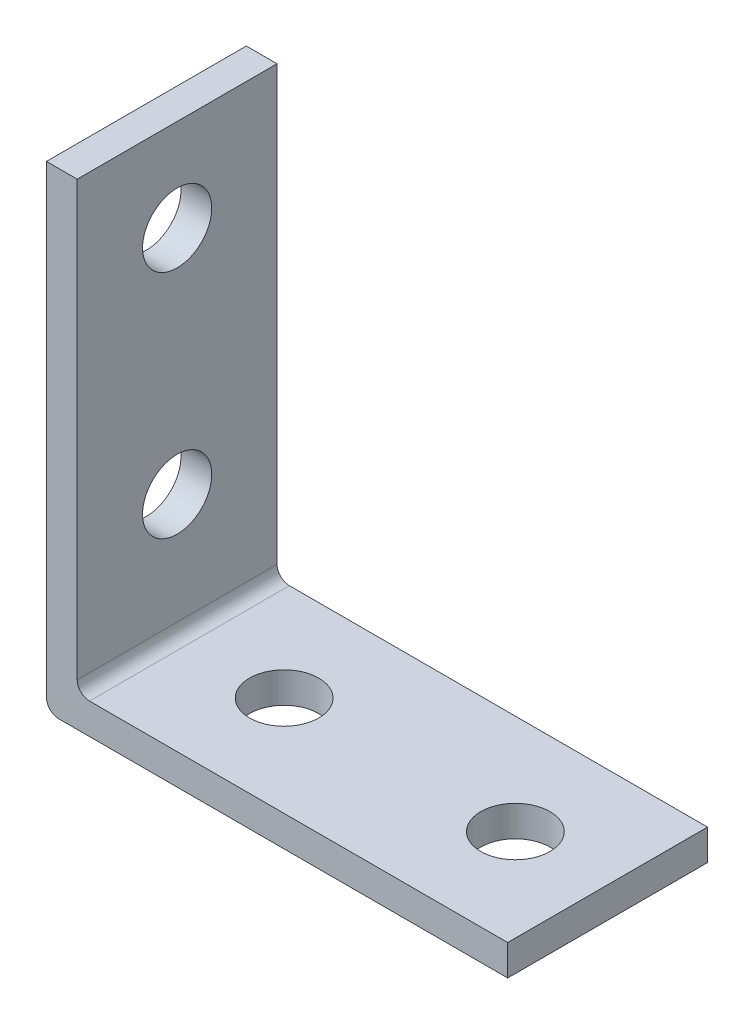
from build123d import *

# Parameters (mm, degrees)
BOSS_EXTRUDE1_DEPTH = 41.275
SKETCH2_R           = 7.14375
CUT_EXTRUDE1_DEPTH  = 41.275
SKETCH3_R           = 7.14375
CUT_EXTRUDE2_DEPTH  = 41.275


with BuildPart() as part:
    # Sketch1 → Boss-Extrude1 (new body)
    with BuildSketch(Plane.XY):
        with BuildLine():
            Line((-35.867305165, 89.962083988), (-42.217305165, 89.962083988))
            Line((-42.217305165, 89.962083988), (-42.217305165, -2.112916012))
            Line((-42.217305165, -2.112916012), (-42.217305165, -5.922916012))
            ThreePointArc((-42.217305165, -5.922916012), (-41.473356389, -7.718967236), (-39.677305165, -8.462916012))
            Line((-39.677305165, -8.462916012), (-35.867305165, -8.462916012))
            Line((-35.867305165, -8.462916012), (53.032694835, -8.462916012))
            Line((53.032694835, -8.462916012), (53.032694835, -2.112916012))
            Line((53.032694835, -2.112916012), (-33.327305165, -2.112916012))
            ThreePointArc((-33.327305165, -2.112916012), (-35.123356389, -1.368967236), (-35.867305165, 0.427083988))
            Line((-35.867305165, 0.427083988), (-35.867305165, 89.962083988))
        make_face()
    extrude(amount=BOSS_EXTRUDE1_DEPTH)

    # Sketch2 → Cut-Extrude1 (cut)
    with BuildSketch(Plane(origin=(-35.867305165, 0, 0), x_dir=(0, 0, -1), z_dir=(1, 0, 0))):
        with Locations(Location((-20.6375, 70.912083988, 0), (0, 0, 90))):
            Circle(SKETCH2_R)
        with Locations(Location((-20.6375, 23.287083988, 0), (0, 0, 90))):
            Circle(SKETCH2_R)
    extrude(amount=-CUT_EXTRUDE1_DEPTH, mode=Mode.SUBTRACT)

    # Sketch3 → Cut-Extrude2 (cut)
    with BuildSketch(Plane(origin=(0, -2.112916012, 0), x_dir=(1, 0, 0), z_dir=(0, 1, 0))):
        with Locations(Location((-13.769305165, -20.6375, 0), (0, 0, 180))):
            Circle(SKETCH3_R)
        with Locations(Location((33.982694835, -20.6375, 0), (0, 0, 180))):
            Circle(SKETCH3_R)
    extrude(amount=-CUT_EXTRUDE2_DEPTH, mode=Mode.SUBTRACT)


solid = part.part
